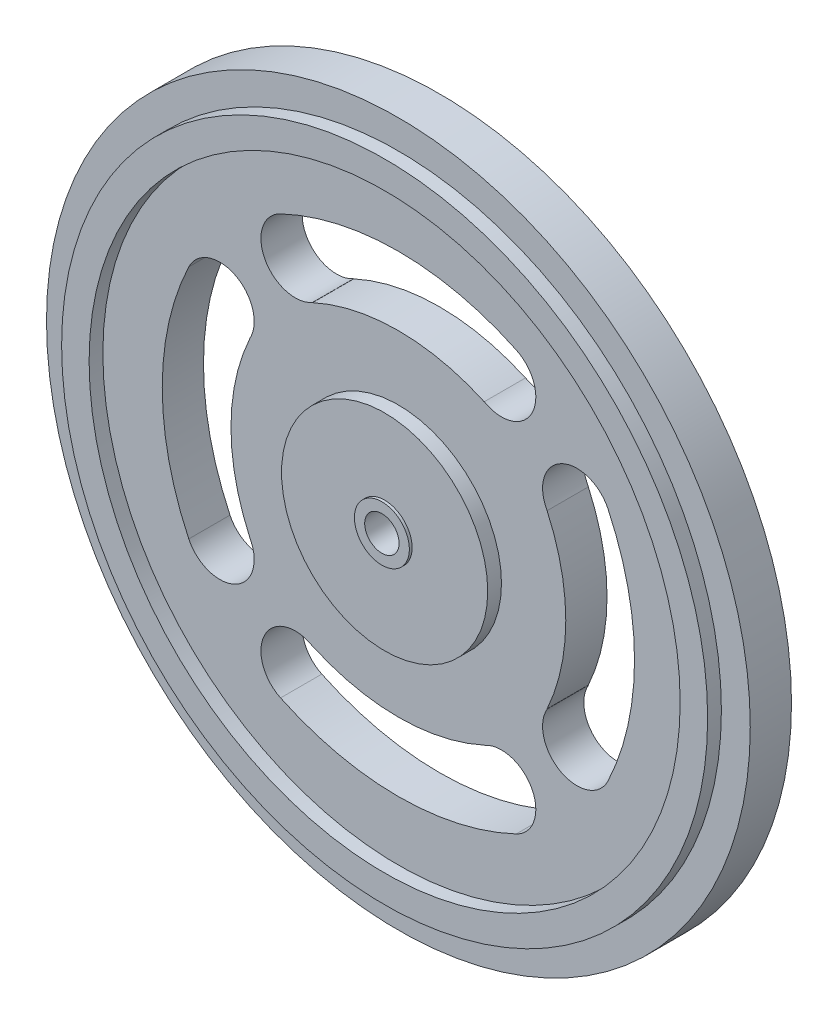
from build123d import *

# Parameters (mm, degrees)
SKETCH1_R           = 32.512
BOSS_EXTRUDE1_DEPTH = 1.905
SKETCH2_R           = 29.845
SKETCH2_R_2         = 27.305
BOSS_EXTRUDE2_DEPTH = 1.27
SKETCH3_R           = 9.525
BOSS_EXTRUDE3_DEPTH = 1.27
CUT_EXTRUDE1_REACH  = 48.136
CIRPATTERN1_COUNT   = 4
SKETCH5_R           = 2.54
SKETCH5_R_2         = 1.5875
BOSS_EXTRUDE4_DEPTH = 0.254
CUT_EXTRUDE2_REACH  = 48.451
SKETCH6_R           = 1.5875


with BuildPart() as part:
    # Sketch1 → Boss-Extrude1 (new, symmetric)
    with BuildSketch(Plane.XY):
        with Locations(Location((0, 0, 0), (0, 0, 180))):
            Circle(SKETCH1_R)
    extrude(amount=BOSS_EXTRUDE1_DEPTH, both=True)

    # Sketch2 → Boss-Extrude2 (add)
    with BuildSketch(Plane.XY.offset(1.905)):
        Circle(SKETCH2_R)
        Circle(SKETCH2_R_2, mode=Mode.SUBTRACT)
    boss_extrude2 = extrude(amount=BOSS_EXTRUDE2_DEPTH)

    # Sketch3 → Boss-Extrude3 (add)
    with BuildSketch(Plane.XY.offset(1.905)):
        Circle(SKETCH3_R)
    boss_extrude3 = extrude(amount=BOSS_EXTRUDE3_DEPTH)

    # Sketch4 → Cut-Extrude1 (cut, up to next)
    with BuildSketch(Plane.XY.offset(1.905), mode=Mode.PRIVATE) as cut_extrude1_sk1:
        with BuildLine():
            ThreePointArc((10.885714286, 19.366421534), (0, 21.8173208), (-10.885714286, 19.366421534))
            ThreePointArc((-10.885714286, 19.366421534), (-12.336421788, 15.022476336), (-7.9375, 13.748153285))
            Line((-7.9375, 13.748153285), (-7.931449378, 13.737673301))
            ThreePointArc((-7.931449378, 13.737673301), (0, 15.4673208), (7.931449378, 13.737673301))
            Line((7.931449378, 13.737673301), (7.9375, 13.748153285))
            ThreePointArc((7.9375, 13.748153285), (12.336421788, 15.022476336), (10.885714286, 19.366421534))
        make_face()
    cut_extrude1_tool1 = extrude(cut_extrude1_sk1.sketch, amount=-CUT_EXTRUDE1_REACH, mode=Mode.PRIVATE) & part.part
    cut_extrude1 = cut_extrude1_tool1.solids().sort_by_distance((0, 17.6348, 1.905))[0]
    add(cut_extrude1, mode=Mode.SUBTRACT)

    # CirPattern1: Cut-Extrude1 ×4 about axis
    cirpattern1_axis = Axis((0, 0, 0), (0, 0, 1))
    for i in range(1, CIRPATTERN1_COUNT):
        add(cut_extrude1.rotate(cirpattern1_axis, i * 360 / CIRPATTERN1_COUNT), mode=Mode.SUBTRACT)

    # Sketch5 → Boss-Extrude4 (add)
    with BuildSketch(Plane.XY.offset(3.175)):
        Circle(SKETCH5_R)
        Circle(SKETCH5_R_2, mode=Mode.SUBTRACT)
    boss_extrude4 = extrude(amount=BOSS_EXTRUDE4_DEPTH)

    # Mirror1: Boss-Extrude2, Boss-Extrude3, Boss-Extrude4 across plane
    add(boss_extrude2.mirror(Plane.XY))
    add(boss_extrude3.mirror(Plane.XY))
    add(boss_extrude4.mirror(Plane.XY))

    # Sketch6 → Cut-Extrude2 (cut, up to next)
    with BuildSketch(Plane.XY.offset(3.175), mode=Mode.PRIVATE) as cut_extrude2_sk1:
        Circle(SKETCH6_R)
    cut_extrude2_tool1 = extrude(cut_extrude2_sk1.sketch, amount=-CUT_EXTRUDE2_REACH, mode=Mode.PRIVATE) & part.part
    add(cut_extrude2_tool1.solids().sort_by_distance((0, 0, 3.175))[0], mode=Mode.SUBTRACT)


solid = part.part
